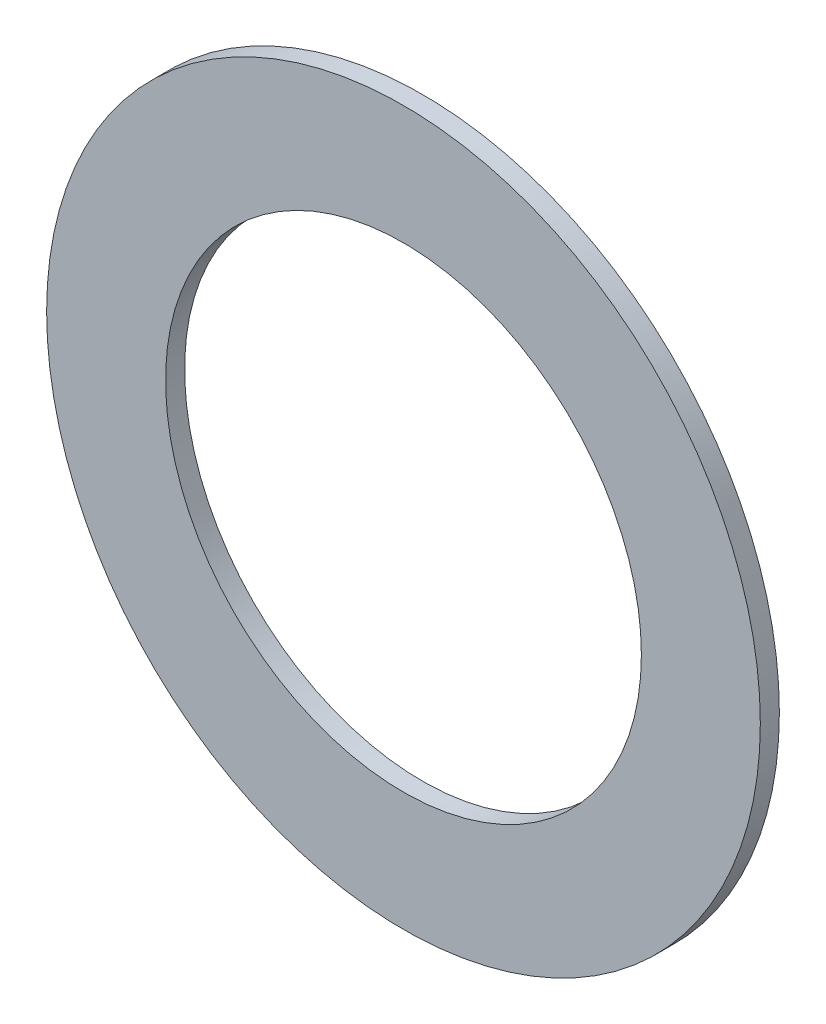
from build123d import *

# Parameters (mm, degrees)
SKETCH3_R           = 4.7625
SKETCH3_R_2         = 3.175
BOSS_EXTRUDE1_DEPTH = 0.127


with BuildPart() as part:
    # Sketch3 → Boss-Extrude1 (new, symmetric)
    with BuildSketch(Plane.XY):
        Circle(SKETCH3_R)
        Circle(SKETCH3_R_2, mode=Mode.SUBTRACT)
    extrude(amount=BOSS_EXTRUDE1_DEPTH, both=True)


solid = part.part
